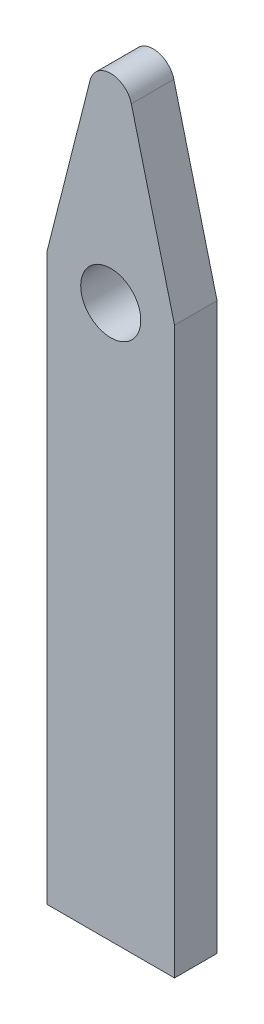
from build123d import *

# Parameters (mm, degrees)
BOSS_EXTRUDE1_DEPTH = 12.7
SKETCH4_R           = 8.976739885
CUT_EXTRUDE1_DEPTH  = 120.43793735


with BuildPart() as part:
    # Sketch1 → Boss-Extrude1 (new body)
    with BuildSketch(Plane.XY):
        with BuildLine():
            Line((19.05, 51.687014291), (6.15479997, 102.487014291))
            ThreePointArc((6.15479997, 102.487014291), (0, 107.274664355), (-6.15479997, 102.487014291))
            Line((-6.15479997, 102.487014291), (-19.05, 51.687014291))
            Line((-19.05, 51.687014291), (-19.05, -117.222985709))
            Line((-19.05, -117.222985709), (19.05, -117.222985709))
            Line((19.05, -117.222985709), (19.05, 51.687014291))
        make_face()
    extrude(amount=BOSS_EXTRUDE1_DEPTH)

    # Sketch4 → Cut-Extrude1 (cut, through all)
    with BuildSketch(Plane(origin=(0, 0, 0), x_dir=(-1, 0, 0), z_dir=(0, 0, -1))):
        with Locations((0, 47.877014291)):
            Circle(SKETCH4_R)
    extrude(amount=-CUT_EXTRUDE1_DEPTH, mode=Mode.SUBTRACT)


solid = part.part
